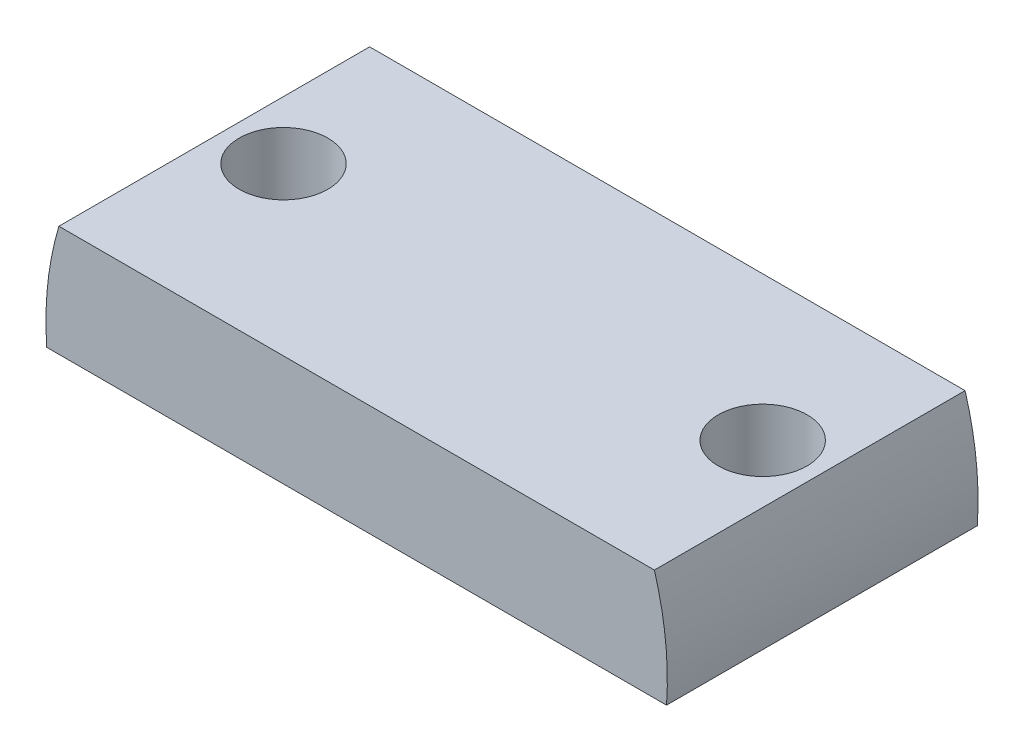
from build123d import *

# Parameters (mm, degrees)
BOSS_EXTRUDE1_DEPTH = 15
SKETCH3_R           = 2
CUT_EXTRUDE1_DEPTH  = 22.117601772
CUT_EXTRUDE3_DEPTH  = 1


with BuildPart() as part:
    # Sketch2 → Boss-Extrude1 (new body)
    with BuildSketch(Plane.XY):
        with BuildLine():
            Line((0, 3.99956576), (-13.41495138, 3.99956576))
            ThreePointArc((-13.41495138, 3.99956576), (-13.915210617, 1.524585285), (-13.962716312, -1))
            Line((-13.962716312, -1), (0, -1))
            Line((0, -1), (13.962716312, -1))
            ThreePointArc((13.962716312, -1), (13.915210617, 1.524585285), (13.41495138, 3.99956576))
            Line((13.41495138, 3.99956576), (0, 3.99956576))
        make_face()
    extrude(amount=BOSS_EXTRUDE1_DEPTH)

    # Sketch3 → Cut-Extrude1 (cut, through all)
    with BuildSketch(Plane(origin=(0, 3.99956576, 0), x_dir=(1, 0, 0), z_dir=(0, 1, 0))):
        with Locations(Location((10.795, -7.5, 0), (0, 0, 270))):
            Circle(SKETCH3_R)
        with Locations(Location((-10.795, -7.5, 0), (0, 0, 90))):
            Circle(SKETCH3_R)
    extrude(amount=-CUT_EXTRUDE1_DEPTH, mode=Mode.SUBTRACT)

    # Sketch4 → Cut-Extrude3 (cut)
    with BuildSketch(Plane.XY):
        with BuildLine():
            Line((13.962716312, -1), (-13.962716312, -1))
            ThreePointArc((-13.962716312, -1), (-13.915210617, 1.524585285), (-13.41495138, 3.99956576))
            Line((-13.41495138, 3.99956576), (0, 3.99956576))
            Line((0, 3.99956576), (13.41495138, 3.99956576))
            ThreePointArc((13.41495138, 3.99956576), (13.915210617, 1.524585285), (13.962716312, -1))
        make_face()
    extrude(amount=CUT_EXTRUDE3_DEPTH, mode=Mode.SUBTRACT)


solid = part.part
